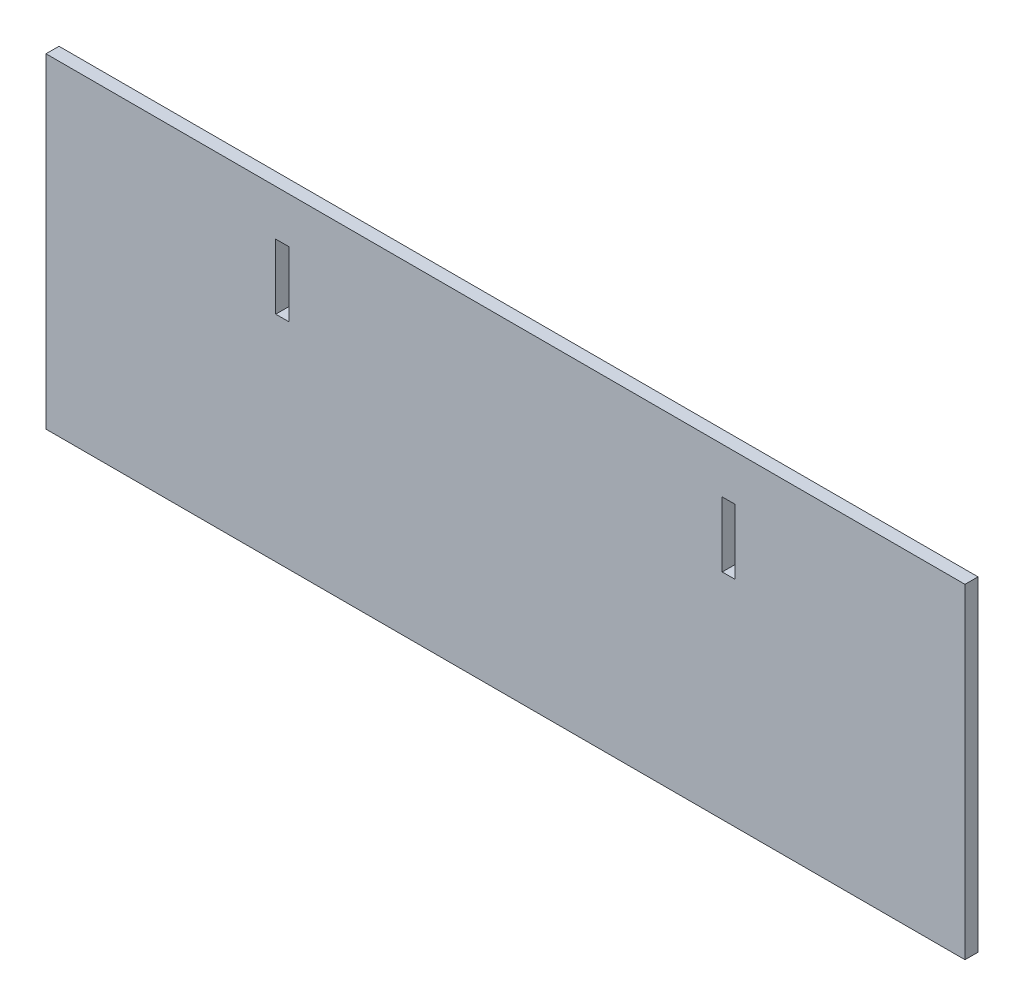
from build123d import *

# Parameters (mm, degrees)
SKETCH1_W           = 212
SKETCH1_H           = 75
SKETCH1_W_2         = 3
SKETCH1_H_2         = 15
BOSS_EXTRUDE1_DEPTH = 3


with BuildPart() as part:
    # Sketch1 → Boss-Extrude1 (new body)
    with BuildSketch(Plane.XY):
        with Locations((106, 37.5)):
            Rectangle(SKETCH1_W, SKETCH1_H)
        with Locations((54.5, 56.97224362)):
            Rectangle(SKETCH1_W_2, SKETCH1_H_2, mode=Mode.SUBTRACT)
        with Locations((157.5, 56.97224362)):
            Rectangle(SKETCH1_W_2, SKETCH1_H_2, mode=Mode.SUBTRACT)
    extrude(amount=BOSS_EXTRUDE1_DEPTH)


solid = part.part
